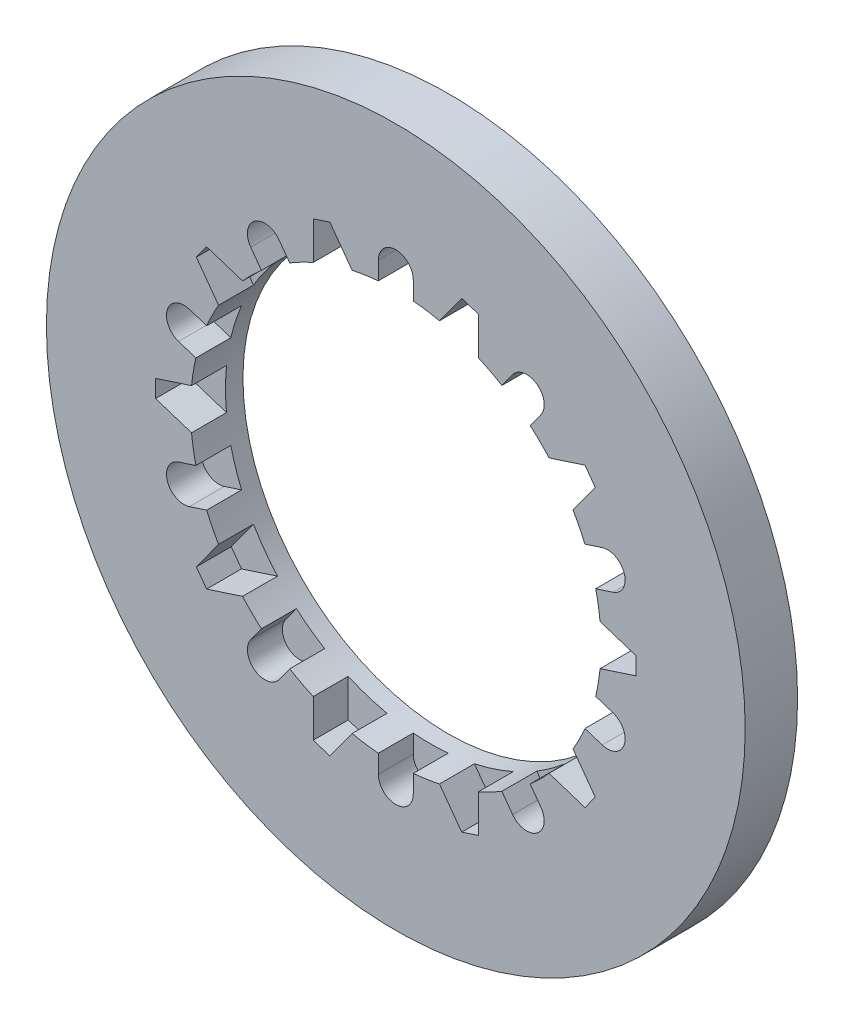
from build123d import *

# Parameters (mm, degrees)
SKETCH2_R           = 40
SKETCH2_R_2         = 23.5
BOSS_EXTRUDE1_DEPTH = 4
CUT_EXTRUDE2_DEPTH  = 10
CIRPATTERN1_COUNT   = 10
BOSS_EXTRUDE2_START = -2
SKETCH2_4_R         = 40
SKETCH2_4_R_2       = 23.5
BOSS_EXTRUDE2_DEPTH = 2


with BuildPart() as part:
    # Sketch2 → Boss-Extrude1 (new body)
    with BuildSketch(Plane.XY):
        Circle(SKETCH2_R)
        Circle(SKETCH2_R_2, mode=Mode.SUBTRACT)
    extrude(amount=BOSS_EXTRUDE1_DEPTH)

    # Sketch2<3> → Cut-Extrude2 (cut)
    with BuildSketch(Plane.XY):
        with BuildLine():
            Line((-7.546910829, 26.463071192), (-9.449023862, 25.845037204))
            Line((-9.449023862, 25.845037204), (-9.449023862, 21.516643513))
            ThreePointArc((-9.449023862, 21.516643513), (-7.261899368, 22.349828133), (-5.002744851, 22.961327138))
            Line((-5.002744851, 22.961327138), (-7.546910829, 26.463071192))
        make_face()
        with BuildLine():
            Line((-2, 25.5), (-2, 23.414738948))
            ThreePointArc((-2, 23.414738948), (0, 23.5), (2, 23.414738948))
            Line((2, 23.414738948), (2, 25.5))
            ThreePointArc((2, 25.5), (0, 27.5), (-2, 25.5))
        make_face()
    cut_extrude2 = extrude(amount=CUT_EXTRUDE2_DEPTH, mode=Mode.SUBTRACT)

    # CirPattern1: Cut-Extrude2 ×10 about axis
    cirpattern1_axis = Axis((0, 0, 0), (0, 0, 1))
    for i in range(1, CIRPATTERN1_COUNT):
        add(cut_extrude2.rotate(cirpattern1_axis, i * 360 / CIRPATTERN1_COUNT), mode=Mode.SUBTRACT)

    # Sketch2<4> → Boss-Extrude2 (add)
    with BuildSketch(Plane.XY.offset(BOSS_EXTRUDE2_START)):
        Circle(SKETCH2_4_R)
        Circle(SKETCH2_4_R_2, mode=Mode.SUBTRACT)
    extrude(amount=BOSS_EXTRUDE2_DEPTH)


solid = part.part
